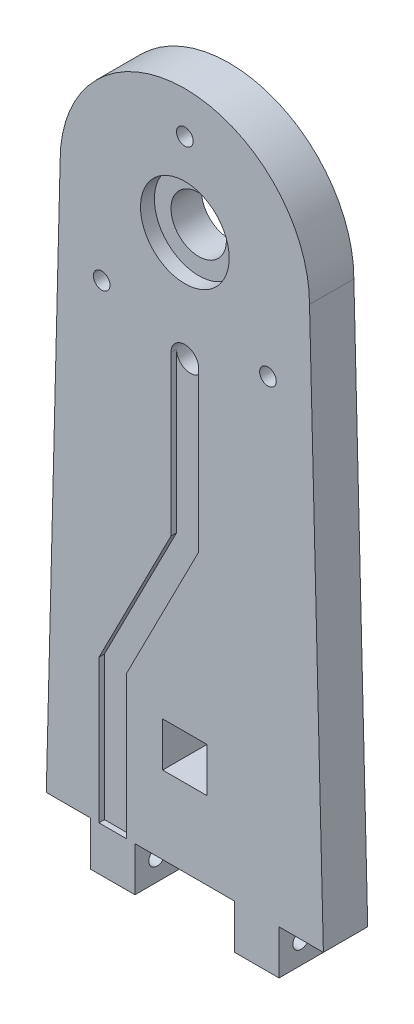
from build123d import *

# Parameters (mm, degrees)
ARM_BOSS_EXTRUDE1_DEPTH                    = 8
SKETCH2_R                                  = 8
BEARING_CUT_EXTRUDE1_DEPTH                 = 2.5
SKETCH3_R                                  = 5
SHAFT_HOLE_CUT_EXTRUDE2_DEPTH              = 5.5
SKETCH4_R                                  = 2.5
CABLE_HOLE_CUT_EXTRUDE3_DEPTH              = 8
SKETCH5_W                                  = 8
SKETCH5_H                                  = 8
PUZZLE_SLOT_BOSS_EXTRUDE2_DEPTH            = 8
SKETCH6_W                                  = 5
SKETCH6_H                                  = 7.5
CABLE_CUT_EXTRUDE4_DEPTH                   = 1
SKETCH7_R                                  = 1.5
MOUNTING_HOLES_CUT_EXTRUDE5_DEPTH          = 8
PUZZLE_SLOT_SCREW_HOLES_CUT_EXTRUDE6_REACH = 118.155
SKETCH8_R                                  = 1.5
SIDE_PUZZLE_SLOT_CUT_EXTRUDE7_DEPTH        = 8
CABLE_LOWER_CUT_EXTRUDE8_DEPTH             = 1


with BuildPart() as part:
    # Sketch1 → Arm Boss-Extrude1 (new body)
    with BuildSketch(Plane.XY):
        with BuildLine():
            Line((-22.5, 0), (-25, -100))
            Line((-25, -100), (0, -100))
            Line((0, -100), (25, -100))
            Line((25, -100), (22.5, 0))
            ThreePointArc((22.5, 0), (0, 22.5), (-22.5, 0))
        make_face()
    extrude(amount=-ARM_BOSS_EXTRUDE1_DEPTH)

    # Sketch2 → Bearing Cut-Extrude1 (cut)
    with BuildSketch(Plane.XY):
        Circle(SKETCH2_R)
    extrude(amount=-BEARING_CUT_EXTRUDE1_DEPTH, mode=Mode.SUBTRACT)

    # Sketch3 → Shaft Hole Cut-Extrude2 (cut)
    with BuildSketch(Plane.XY.offset(-2.5)):
        Circle(SKETCH3_R)
    extrude(amount=-SHAFT_HOLE_CUT_EXTRUDE2_DEPTH, mode=Mode.SUBTRACT)

    # Sketch4 → Cable Hole Cut-Extrude3 (cut)
    with BuildSketch(Plane.XY):
        with Locations((0, -20)):
            Circle(SKETCH4_R)
    extrude(amount=-CABLE_HOLE_CUT_EXTRUDE3_DEPTH, mode=Mode.SUBTRACT)

    # Sketch5 → Puzzle Slot Boss-Extrude2 (add)
    with BuildSketch(Plane.XZ.offset(100)):
        with Locations((-13, -4)):
            Rectangle(SKETCH5_W, SKETCH5_H)
        with Locations((13, -4)):
            Rectangle(SKETCH5_W, SKETCH5_H)
    extrude(amount=PUZZLE_SLOT_BOSS_EXTRUDE2_DEPTH)

    # Sketch6 → Cable Cut-Extrude4 (cut)
    with BuildSketch(Plane.XY):
        with Locations((0, -23.75)):
            Rectangle(SKETCH6_W, SKETCH6_H)
    extrude(amount=-CABLE_CUT_EXTRUDE4_DEPTH, mode=Mode.SUBTRACT)

    # Sketch7 → Mounting Holes Cut-Extrude5 (cut)
    with BuildSketch(Plane.XY):
        with Locations((-15, -15)):
            Circle(SKETCH7_R)
        with Locations((15, -15)):
            Circle(SKETCH7_R)
        with Locations((0, 15)):
            Circle(SKETCH7_R)
    extrude(amount=-MOUNTING_HOLES_CUT_EXTRUDE5_DEPTH, mode=Mode.SUBTRACT)

    # Puzzle Slot Screw Holes Cut-Extrude6: up to this face of the body (flat: up to its plane)
    puzzle_slot_screw_holes_cut_extrude6_end = Plane(part.part.faces().sort_by_distance((17, -104, -4))[0])
    # Sketch8 → Puzzle Slot Screw Holes Cut-Extrude6 (cut, up to the picked face)
    with BuildSketch(Plane.ZY.offset(17), mode=Mode.PRIVATE) as puzzle_slot_screw_holes_cut_extrude6_sk1:
        with Locations((-4, -104)):
            Circle(SKETCH8_R)
    puzzle_slot_screw_holes_cut_extrude6_tool1 = split(extrude(puzzle_slot_screw_holes_cut_extrude6_sk1.sketch, amount=-PUZZLE_SLOT_SCREW_HOLES_CUT_EXTRUDE6_REACH, mode=Mode.PRIVATE), bisect_by=puzzle_slot_screw_holes_cut_extrude6_end, keep=Keep.BOTH, mode=Mode.PRIVATE)
    add(puzzle_slot_screw_holes_cut_extrude6_tool1.solids().sort_by(Axis((-17, -104, -4), (1, 0, 0)))[0], mode=Mode.SUBTRACT)

    # Sketch9 → Side Puzzle Slot Cut-Extrude7 (cut)
    with BuildSketch(Plane.XY):
        Polygon((-4, -78), (0, -78), (4, -78), (4, -86), (-4, -86), align=None)
    extrude(amount=-SIDE_PUZZLE_SLOT_CUT_EXTRUDE7_DEPTH, mode=Mode.SUBTRACT)

    # Sketch10 → Cable Lower Cut-Extrude8 (cut)
    with BuildSketch(Plane.XY):
        Polygon((-15.5, -100), (-10.5, -100), (-10.5, -74.117724453), (2.5, -48.683858805), (2.5, -27.5), (-2.5, -27.5), (-2.5, -48.683858805), (-15.5, -74.117724453), align=None)
    extrude(amount=-CABLE_LOWER_CUT_EXTRUDE8_DEPTH, mode=Mode.SUBTRACT)


solid = part.part
